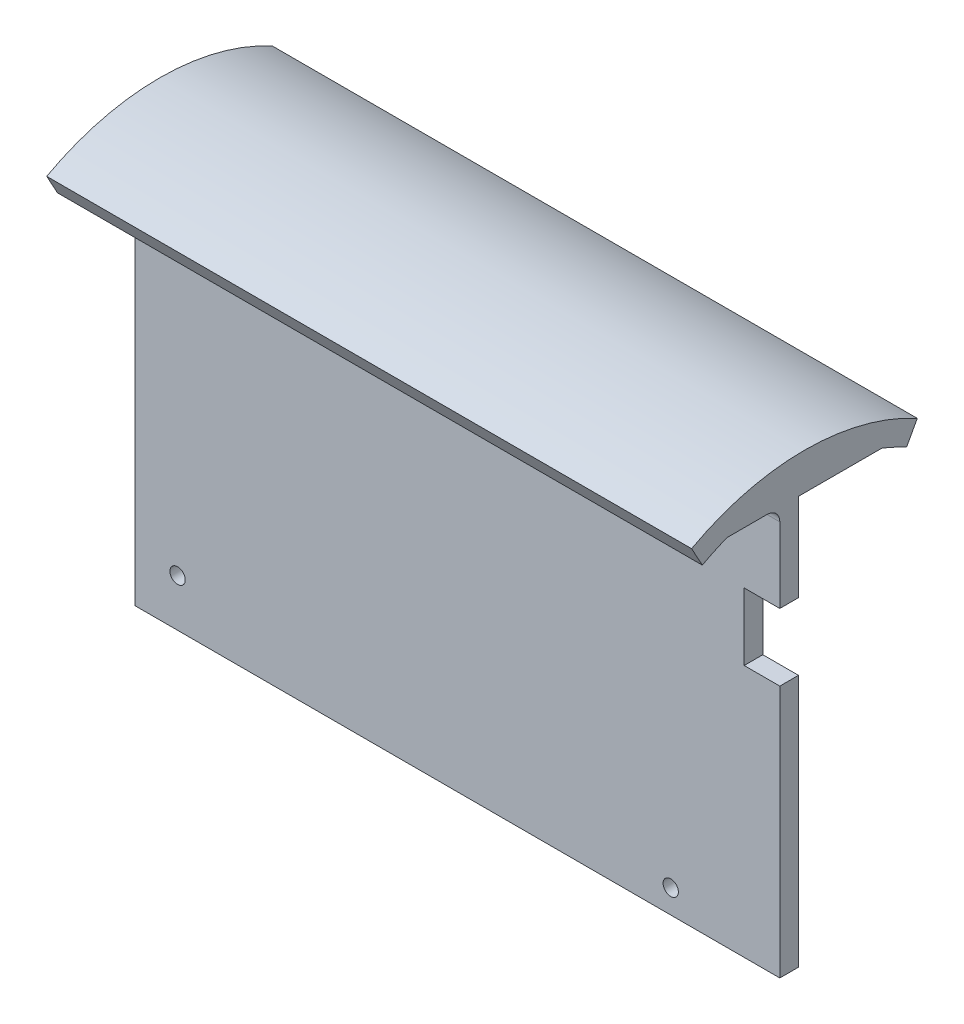
from build123d import *

# Parameters (mm, degrees)
ESBO_O1_R                                 = 5
ESBO_O1_R_2                               = 4
RESSALTO_EXTRUS_O4_DEPTH                  = 2.5
ESBO_O7_R                                 = 3.0875
RESSALTO_EXTRUS_O5_DEPTH                  = 2.5
BROCA_DE_ROSQUEAR_PARA_TARRAXA_DE_M2_51_D = 2.05
RESSALTO_EXTRUS_O6_REACH                  = 92.839


with BuildPart() as part:
    # Esboço1 → Ressalto-extrusão4 (new body)
    with BuildSketch(Plane.XY):
        Polygon((36.83, 26.550055291), (-30.48, 26.550055291), (-43.18, 26.550055291), (-43.18, 13.850055291), (-43.18, -15.359944709), (-43.18, -28.059944709), (-30.48, -28.059944709), (36.83, -28.059944709), (43.18, -28.059944709), (43.18, -21.709944709), (43.18, 5.794055291), (38.407682724, 5.794055291), (38.407682724, 14.794055291), (43.18, 14.794055291), (43.18, 20.200055291), (43.18, 26.550055291), align=None)
        with Locations((-18.322924579, 20.487241898)):
            Circle(ESBO_O1_R, mode=Mode.SUBTRACT)
        with Locations((-4.227566255, 21.406055391)):
            Circle(ESBO_O1_R_2, mode=Mode.SUBTRACT)
        with Locations((20.844433745, 18.879055391)):
            Circle(ESBO_O1_R_2, mode=Mode.SUBTRACT)
    extrude(amount=RESSALTO_EXTRUS_O4_DEPTH)

    # Esboço7 → Ressalto-extrusão5 (add)
    with BuildSketch(Plane(origin=(0, 0, 0), x_dir=(-1, 0, 0), z_dir=(0, 0, -1))):
        with Locations(Location((37.465, -21.709944709, 0), (0, 0, 180))):
            Circle(ESBO_O7_R)
        with Locations(Location((37.465, 20.200055291, 0), (0, 0, 180))):
            Circle(ESBO_O7_R)
        with Locations(Location((-28.575, 23.375055291, 0), (0, 0, 180))):
            Circle(ESBO_O7_R)
        with Locations(Location((-28.575, -24.884944709, 0), (0, 0, 180))):
            Circle(ESBO_O7_R)
    extrude(amount=RESSALTO_EXTRUS_O5_DEPTH)

    # Broca de rosquear para tarraxa de M2.51 (through all)
    with Locations(Plane(origin=(28.575, 23.375055291, -2.5), x_dir=(-1, 0, 0), z_dir=(0, 0, -1))):
        with Locations((0, 0), (66.04, -3.175), (0, -48.26), (66.04, -45.085)):
            Hole(BROCA_DE_ROSQUEAR_PARA_TARRAXA_DE_M2_51_D / 2)

    # Ressalto-extrusão6: up to this face of the body (flat: up to its plane)
    ressalto_extrus_o6_end = Plane(part.part.faces().sort_by_distance((43.18, 20.672055291, 1.25))[0])
    # Esboço9 → Ressalto-extrusão6 (add, up to the picked face)
    with BuildSketch(Plane.ZY.offset(43.18), mode=Mode.PRIVATE) as ressalto_extrus_o6_sk1:
        with BuildLine():
            Line((2.5, 24.836642303), (2.5, 26.550055291))
            Line((2.5, 26.550055291), (0, 26.550055291))
            Line((0, 26.550055291), (-11.160722179, 26.550055291))
            ThreePointArc((-11.160722179, 26.550055291), (-12.841855689, 25.831060984), (-14.473425786, 25.005747885))
            Line((-14.473425786, 25.005747885), (-15.912733763, 27.637931873))
            ThreePointArc((-15.912733763, 27.637931873), (-0.8, 31.5), (14.312733763, 27.637931873))
            Line((14.312733763, 27.637931873), (12.873425786, 25.005747885))
            ThreePointArc((12.873425786, 25.005747885), (11.241855689, 25.831060984), (9.560722179, 26.550055291))
            Line((9.560722179, 26.550055291), (4.213412987, 26.550055291))
            ThreePointArc((4.213412987, 26.550055291), (3.001847045, 26.048208246), (2.5, 24.836642303))
        make_face()
    ressalto_extrus_o6_tool1 = split(extrude(ressalto_extrus_o6_sk1.sketch, amount=-RESSALTO_EXTRUS_O6_REACH, mode=Mode.PRIVATE), bisect_by=ressalto_extrus_o6_end, keep=Keep.BOTH, mode=Mode.PRIVATE)
    add(ressalto_extrus_o6_tool1.solids().sort_by(Axis((-43.18, 28.43855, -0.780308), (1, 0, 0)))[0])


solid = part.part
